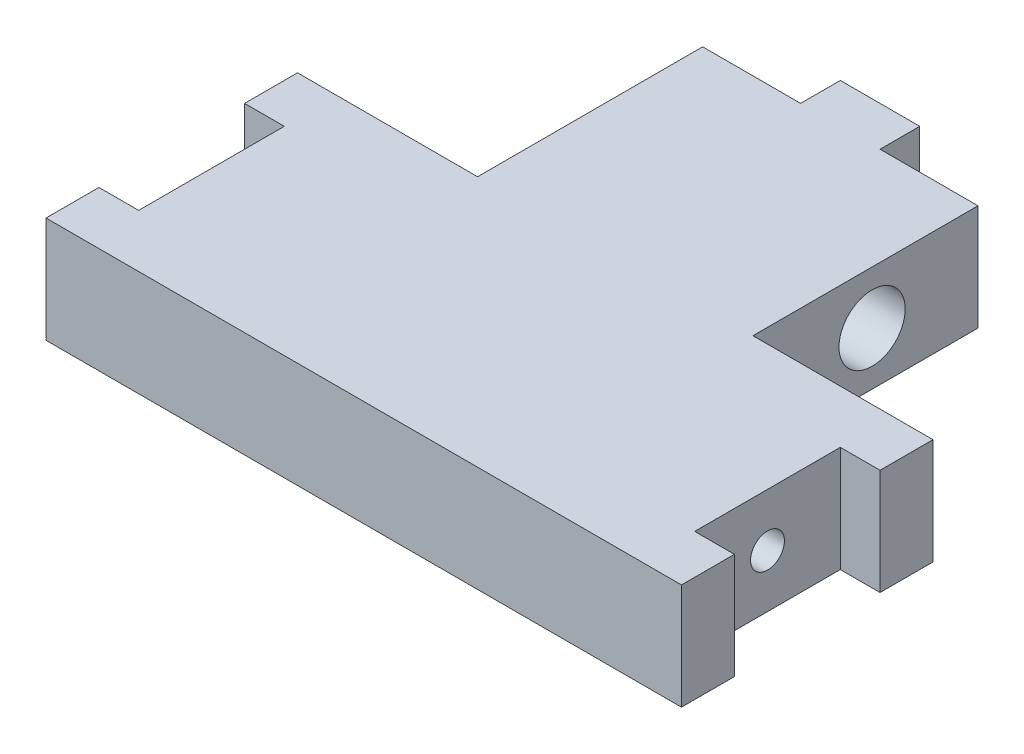
from build123d import *

# Parameters (mm, degrees)
BOSS_EXTRUDE1_DEPTH = 12.7
SKETCH2_R           = 2.032
SKETCH2_R_2         = 3.96875
CUT_EXTRUDE1_DEPTH  = 93.361945119
SKETCH3_R           = 1.1303
CUT_EXTRUDE2_DEPTH  = 4.7625


with BuildPart() as part:
    # Sketch1 → Boss-Extrude1 (new body)
    with BuildSketch(Plane(origin=(0, 0, 0), x_dir=(1, 0, 0), z_dir=(0, 1, 0))):
        Polygon((16.51, 0), (4.7625, 0), (4.7625, 4.7625), (-4.7625, 4.7625), (-4.7625, 0), (-16.51, 0), (-16.51, -26.9875), (-38.1, -26.9875), (-38.1, -33.3375), (-33.3375, -33.3375), (-33.3375, -50.8), (-38.1, -50.8), (-38.1, -57.15), (38.1, -57.15), (38.1, -50.8), (33.3375, -50.8), (33.3375, -33.3375), (38.1, -33.3375), (38.1, -26.9875), (16.51, -26.9875), align=None)
    extrude(amount=BOSS_EXTRUDE1_DEPTH)

    # Sketch2 → Cut-Extrude1 (cut, through all)
    with BuildSketch(Plane(origin=(33.3375, 0, 0), x_dir=(0, 0, -1), z_dir=(1, 0, 0))):
        with Locations((-42.06875, 6.35)):
            Circle(SKETCH2_R)
        with Locations((-12.7, 6.35)):
            Circle(SKETCH2_R_2)
    extrude(amount=-CUT_EXTRUDE1_DEPTH, mode=Mode.SUBTRACT)

    # Sketch3 → Cut-Extrude2 (cut)
    with BuildSketch(Plane(origin=(0, 0, 0), x_dir=(-1, 0, 0), z_dir=(0, 0, -1))):
        with Locations((-10.16, 6.35)):
            Circle(SKETCH3_R)
        with Locations((10.16, 6.35)):
            Circle(SKETCH3_R)
    extrude(amount=-CUT_EXTRUDE2_DEPTH, mode=Mode.SUBTRACT)


solid = part.part
